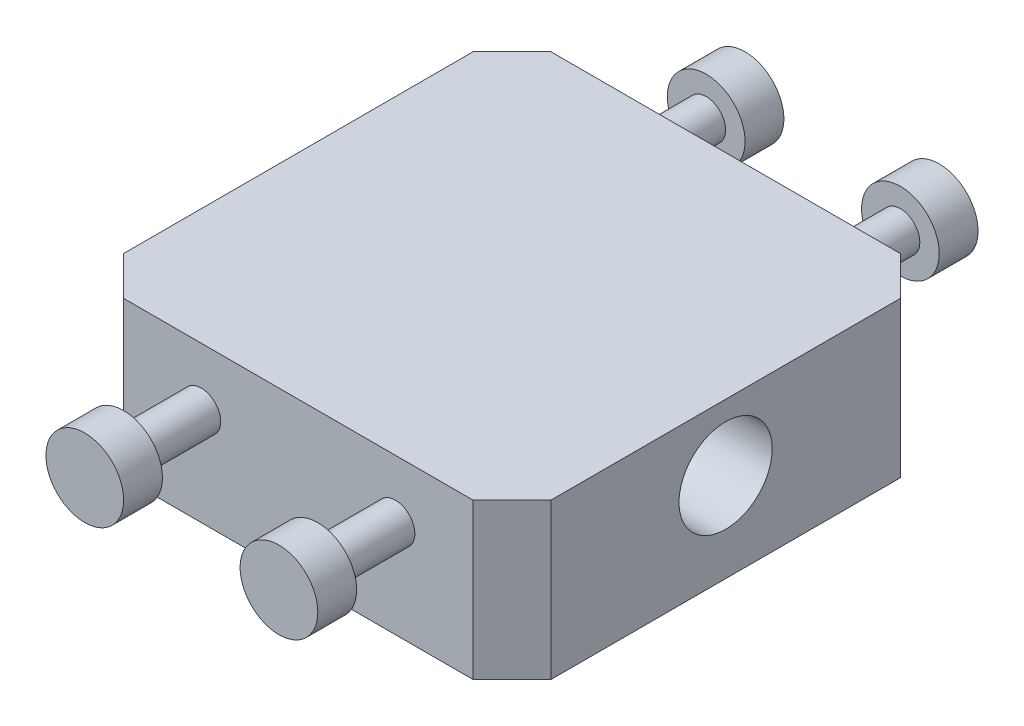
from build123d import *

# Parameters (mm, degrees)
SKETCH2_W           = 110
SKETCH2_H           = 110
BOSS_EXTRUDE1_DEPTH = 30
CHAMFER1_SIZE       = 10
SKETCH3_R           = 5
BOSS_EXTRUDE2_DEPTH = 20
BOSS_EXTRUDE3_START = 20
SKETCH4_R           = 5
BOSS_EXTRUDE3_DEPTH = 20
SKETCH5_R           = 10
BOSS_EXTRUDE4_DEPTH = 10
BOSS_EXTRUDE5_START = 10
SKETCH6_R           = 10
BOSS_EXTRUDE5_DEPTH = 10
BOSS_EXTRUDE6_DEPTH = 5
BOSS_EXTRUDE7_DEPTH = 5
SKETCH15_R          = 12
CUT_EXTRUDE1_DEPTH  = 200


with BuildPart() as part:
    # Sketch2 → Boss-Extrude1 (new body)
    with BuildSketch(Plane(origin=(0, 0, 0), x_dir=(1, 0, 0), z_dir=(0, 1, 0))):
        with Locations((55, 55)):
            Rectangle(SKETCH2_W, SKETCH2_H)
    extrude(amount=BOSS_EXTRUDE1_DEPTH)

    # Chamfer1
    chamfer1_edges = [part.edges().sort_by_distance(p)[0] for p in [
        (0, 15, -110),
        (110, 15, -110),
        (110, 15, 0),
        (0, 15, 0),
    ]]
    chamfer(chamfer1_edges, length=CHAMFER1_SIZE)

    # Sketch3 → Boss-Extrude2 (add)
    with BuildSketch(Plane.XY):
        with Locations(Location((30, 20, 0), (0, 0, 180))):
            Circle(SKETCH3_R)
        with Locations(Location((80, 20, 0), (0, 0, 180))):
            Circle(SKETCH3_R)
    extrude(amount=BOSS_EXTRUDE2_DEPTH)

    # Sketch4 → Boss-Extrude3 (add)
    with BuildSketch(Plane(origin=(0, 0, -110), x_dir=(-1, 0, 0), z_dir=(0, 0, -1)).offset(BOSS_EXTRUDE3_START)):
        with Locations((-80, 20)):
            Circle(SKETCH4_R)
        with Locations((-30, 20)):
            Circle(SKETCH4_R)
    extrude(amount=-BOSS_EXTRUDE3_DEPTH)

    # Sketch5 → Boss-Extrude4 (add)
    with BuildSketch(Plane(origin=(0, 0, -130), x_dir=(-1, 0, 0), z_dir=(0, 0, -1))):
        with Locations((-80, 20)):
            Circle(SKETCH5_R)
        with Locations((-30, 20)):
            Circle(SKETCH5_R)
    extrude(amount=BOSS_EXTRUDE4_DEPTH)

    # Sketch6 → Boss-Extrude5 (add)
    with BuildSketch(Plane.XY.offset(20).offset(BOSS_EXTRUDE5_START)):
        with Locations(Location((30, 20, 0), (0, 0, 180))):
            Circle(SKETCH6_R)
        with Locations(Location((80, 20, 0), (0, 0, 180))):
            Circle(SKETCH6_R)
    extrude(amount=-BOSS_EXTRUDE5_DEPTH)

    # Sketch9 → Boss-Extrude6 (add)
    with BuildSketch(Plane(origin=(0, 30, 0), x_dir=(1, 0, 0), z_dir=(0, 1, 0))):
        Polygon((10, 110), (100, 110), (110, 100), (110, 10), (100, 0), (10, 0), (0, 10), (0, 100), align=None)
    extrude(amount=BOSS_EXTRUDE6_DEPTH)

    # Sketch10 → Boss-Extrude7 (add)
    with BuildSketch(Plane.XZ):
        Polygon((10, 0), (100, 0), (110, -10), (110, -100), (100, -110), (10, -110), (0, -100), (0, -10), align=None)
    extrude(amount=BOSS_EXTRUDE7_DEPTH)

    # Sketch15 → Cut-Extrude1 (cut)
    with BuildSketch(Plane(origin=(110, 0, 0), x_dir=(0, 0, -1), z_dir=(1, 0, 0))):
        with Locations((55, 18)):
            Circle(SKETCH15_R)
    extrude(amount=-CUT_EXTRUDE1_DEPTH, mode=Mode.SUBTRACT)


solid = part.part
